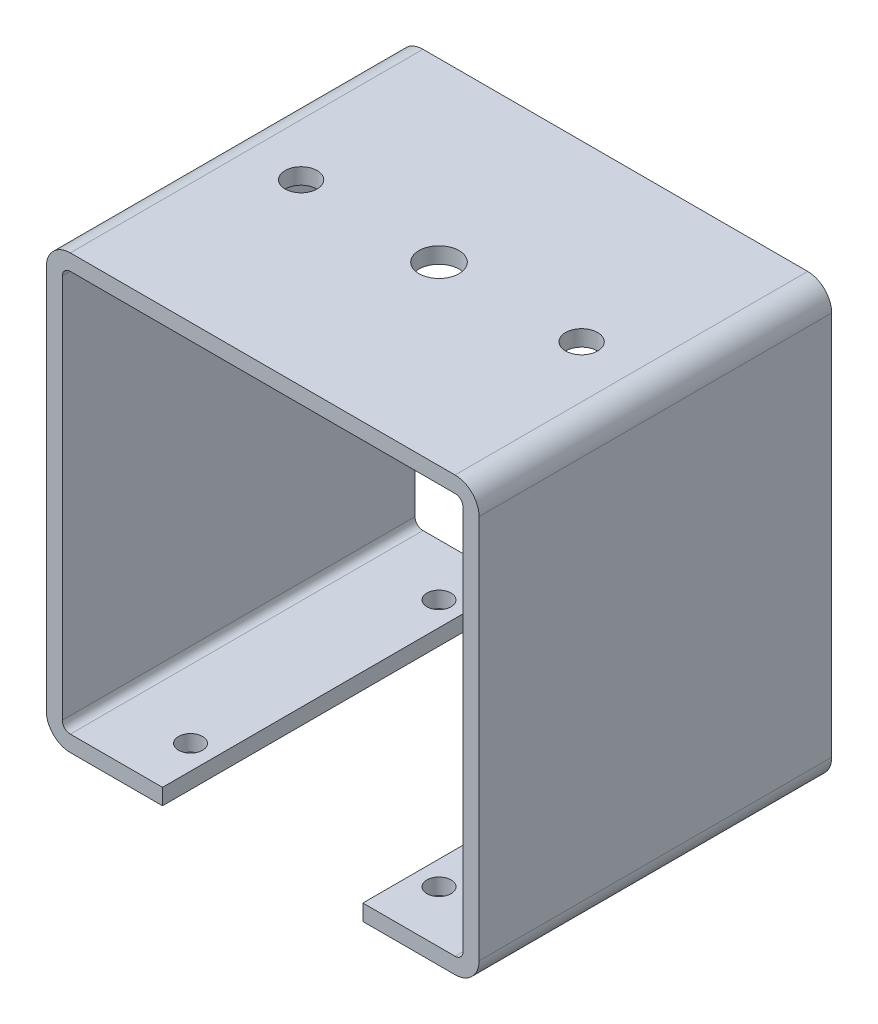
from build123d import *

# Parameters (mm, degrees)
BOSS_EXTRUDE1_DEPTH = 44
SKETCH2_R           = 1.5
CUT_EXTRUDE1_DEPTH  = 32
SKETCH3_R           = 2.5
CUT_EXTRUDE2_DEPTH  = 74.273460407
SKETCH4_R           = 2
CUT_EXTRUDE3_DEPTH  = 44
FILLET1_R           = 1
FILLET2_R           = 3


with BuildPart() as part:
    # Sketch1 → Boss-Extrude1 (new body)
    with BuildSketch(Plane.XY):
        Polygon((-25, 50), (25, 50), (25, 0), (12.5, 0), (12.5, -2), (27, -2), (27, 52), (-27, 52), (-27, -2), (-12.5, -2), (-12.5, 0), (-25, 0), align=None)
    extrude(amount=BOSS_EXTRUDE1_DEPTH)

    # Sketch2 → Cut-Extrude1 (cut)
    with BuildSketch(Plane(origin=(0, -2, 0), x_dir=(-1, 0, 0), z_dir=(0, -1, 0))):
        with Locations(Location((15.5, -37.5, 0), (0, 0, 180))):
            Circle(SKETCH2_R)
        with Locations(Location((-15.5, -37.5, 0), (0, 0, 180))):
            Circle(SKETCH2_R)
        with Locations(Location((-15.5, -6.5, 0), (0, 0, 180))):
            Circle(SKETCH2_R)
        with Locations(Location((15.5, -6.5, 0), (0, 0, 180))):
            Circle(SKETCH2_R)
    extrude(amount=-CUT_EXTRUDE1_DEPTH, mode=Mode.SUBTRACT)

    # Sketch3 → Cut-Extrude2 (cut, through all)
    with BuildSketch(Plane.XZ.offset(-50)):
        with Locations((0, 22)):
            Circle(SKETCH3_R)
    extrude(amount=-CUT_EXTRUDE2_DEPTH, mode=Mode.SUBTRACT)

    # Sketch4 → Cut-Extrude3 (cut)
    with BuildSketch(Plane(origin=(0, 52, 0), x_dir=(1, 0, 0), z_dir=(0, 1, 0))):
        with Locations(Location((-17.5, -21.704916057, 0), (0, 0, 270))):
            Circle(SKETCH4_R)
        with Locations(Location((17.5, -21.704916057, 0), (0, 0, 180))):
            Circle(SKETCH4_R)
    extrude(amount=-CUT_EXTRUDE3_DEPTH, mode=Mode.SUBTRACT)

    # Fillet1
    fillet1_edges = [part.edges().sort_by_distance(p)[0] for p in [
        (25, 0, 22),
        (25, 50, 22),
        (-25, 50, 22),
        (-25, 0, 22),
    ]]
    fillet(fillet1_edges, radius=FILLET1_R)

    # Fillet2
    fillet2_edges = [part.edges().sort_by_distance(p)[0] for p in [
        (-27, -2, 22),
        (-27, 52, 22),
        (27, 52, 22),
        (27, -2, 22),
    ]]
    fillet(fillet2_edges, radius=FILLET2_R)


solid = part.part
